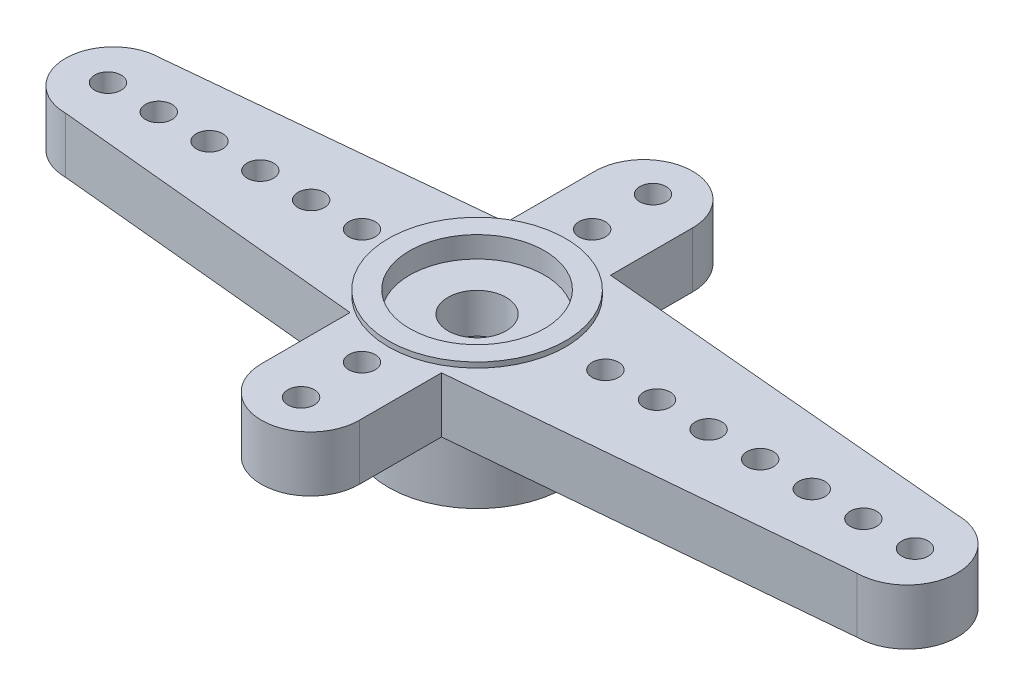
from build123d import *

# Parameters (mm, degrees)
ESQUISSE1_R             = 1.1
BOSS_EXTRU_1_DEPTH      = 2.1
ESQUISSE2_R             = 3.35
ESQUISSE2_R_2           = 2.55
BOSS_EXTRU_2_DEPTH      = 0.2
ENL_V_START             = -0.8
ESQUISSE9_R             = 2.55
ENL_V_MAT_EXTRU_4_DEPTH = 0.8
BOSS_EXTRU_3_START      = 2.5
ESQUISSE5_R             = 3.35
ESQUISSE5_R_2           = 2.55
BOSS_EXTRU_3_DEPTH      = 4.8
ENL_V_MAT_EXTRU_3_REACH = 26.785
ESQUISSE7_R             = 0.5


with BuildPart() as part:
    # Esquisse1 → Boss.-Extru.1 (new body)
    with BuildSketch(Plane(origin=(0, 0, 0), x_dir=(1, 0, 0), z_dir=(0, 1, 0))):
        with BuildLine():
            Line((8.85, 1.9), (-5.55, 3.193286234))
            Line((-5.55, 3.193286234), (-5.55, 6.3))
            ThreePointArc((-5.55, 6.3), (-7.4, 8.15), (-9.25, 6.3))
            Line((-9.25, 6.3), (-9.25, 2.95))
            Line((-9.25, 2.95), (-21.15, 1.8))
            ThreePointArc((-21.15, 1.8), (-22.95, 0), (-21.15, -1.8))
            Line((-21.15, -1.8), (-9.25, -2.95))
            Line((-9.25, -2.95), (-9.25, -6.3))
            ThreePointArc((-9.25, -6.3), (-7.4, -8.15), (-5.55, -6.3))
            Line((-5.55, -6.3), (-5.55, -3.193286234))
            Line((-5.55, -3.193286234), (8.85, -1.9))
            ThreePointArc((8.85, -1.9), (10.75, 0), (8.85, 1.9))
        make_face()
        with Locations(Location((-7.4, 0, 0), (0, 0, 270))):
            Circle(ESQUISSE1_R, mode=Mode.SUBTRACT)
    extrude(amount=BOSS_EXTRU_1_DEPTH)

    # Esquisse2 → Boss.-Extru.2 (add)
    with BuildSketch(Plane(origin=(0, 2.1, 0), x_dir=(1, 0, 0), z_dir=(0, 1, 0))):
        with Locations(Location((-7.4, 0, 0), (0, 0, 270))):
            Circle(ESQUISSE2_R)
        with Locations(Location((-7.4, 0, 0), (0, 0, 270))):
            Circle(ESQUISSE2_R_2, mode=Mode.SUBTRACT)
    extrude(amount=BOSS_EXTRU_2_DEPTH)

    # Esquisse9 → Enlèv. mat.-Extru.4 (cut)
    with BuildSketch(Plane(origin=(0, 2.3, 0), x_dir=(1, 0, 0), z_dir=(0, 1, 0)).offset(ENL_V_START)):
        with Locations(Location((-7.4, 0, 0), (0, 0, 270))):
            Circle(ESQUISSE9_R)
    extrude(amount=ENL_V_MAT_EXTRU_4_DEPTH, mode=Mode.SUBTRACT)

    # Esquisse5 → Boss.-Extru.3 (add)
    with BuildSketch(Plane.XZ.offset(BOSS_EXTRU_3_START)):
        with Locations(Location((-7.4, 0, 0), (0, 0, 90))):
            Circle(ESQUISSE5_R)
        with Locations(Location((-7.4, 0, 0), (0, 0, 90))):
            Circle(ESQUISSE5_R_2, mode=Mode.SUBTRACT)
    extrude(amount=-BOSS_EXTRU_3_DEPTH)

    # Esquisse7 → Enlèv. mat.-Extru.3 (cut, up to next)
    with BuildSketch(Plane(origin=(0, 2.1, 0), x_dir=(1, 0, 0), z_dir=(0, 1, 0)), mode=Mode.PRIVATE) as enl_v_mat_extru_3_sk1:
        with Locations(Location((-7.4, 4.35, 0), (0, 0, 270))):
            Circle(ESQUISSE7_R)
    enl_v_mat_extru_3_tool1 = extrude(enl_v_mat_extru_3_sk1.sketch, amount=-ENL_V_MAT_EXTRU_3_REACH, mode=Mode.PRIVATE) & part.part
    # Esquisse7 → Enlèv. mat.-Extru.3 (cut, up to next)
    with BuildSketch(Plane(origin=(0, 2.1, 0), x_dir=(1, 0, 0), z_dir=(0, 1, 0)), mode=Mode.PRIVATE) as enl_v_mat_extru_3_sk2:
        with Locations(Location((-7.4, 6.65, 0), (0, 0, 270))):
            Circle(ESQUISSE7_R)
    enl_v_mat_extru_3_tool2 = extrude(enl_v_mat_extru_3_sk2.sketch, amount=-ENL_V_MAT_EXTRU_3_REACH, mode=Mode.PRIVATE) & part.part
    # Esquisse7 → Enlèv. mat.-Extru.3 (cut, up to next)
    with BuildSketch(Plane(origin=(0, 2.1, 0), x_dir=(1, 0, 0), z_dir=(0, 1, 0)), mode=Mode.PRIVATE) as enl_v_mat_extru_3_sk3:
        with Locations(Location((-2.55, 0, 0), (0, 0, 270))):
            Circle(ESQUISSE7_R)
    enl_v_mat_extru_3_tool3 = extrude(enl_v_mat_extru_3_sk3.sketch, amount=-ENL_V_MAT_EXTRU_3_REACH, mode=Mode.PRIVATE) & part.part
    # Esquisse7 → Enlèv. mat.-Extru.3 (cut, up to next)
    with BuildSketch(Plane(origin=(0, 2.1, 0), x_dir=(1, 0, 0), z_dir=(0, 1, 0)), mode=Mode.PRIVATE) as enl_v_mat_extru_3_sk4:
        with Locations(Location((-0.6, 0, 0), (0, 0, 270))):
            Circle(ESQUISSE7_R)
    enl_v_mat_extru_3_tool4 = extrude(enl_v_mat_extru_3_sk4.sketch, amount=-ENL_V_MAT_EXTRU_3_REACH, mode=Mode.PRIVATE) & part.part
    # Esquisse7 → Enlèv. mat.-Extru.3 (cut, up to next)
    with BuildSketch(Plane(origin=(0, 2.1, 0), x_dir=(1, 0, 0), z_dir=(0, 1, 0)), mode=Mode.PRIVATE) as enl_v_mat_extru_3_sk5:
        with Locations(Location((1.35, 0, 0), (0, 0, 270))):
            Circle(ESQUISSE7_R)
    enl_v_mat_extru_3_tool5 = extrude(enl_v_mat_extru_3_sk5.sketch, amount=-ENL_V_MAT_EXTRU_3_REACH, mode=Mode.PRIVATE) & part.part
    # Esquisse7 → Enlèv. mat.-Extru.3 (cut, up to next)
    with BuildSketch(Plane(origin=(0, 2.1, 0), x_dir=(1, 0, 0), z_dir=(0, 1, 0)), mode=Mode.PRIVATE) as enl_v_mat_extru_3_sk6:
        with Locations(Location((3.3, 0, 0), (0, 0, 270))):
            Circle(ESQUISSE7_R)
    enl_v_mat_extru_3_tool6 = extrude(enl_v_mat_extru_3_sk6.sketch, amount=-ENL_V_MAT_EXTRU_3_REACH, mode=Mode.PRIVATE) & part.part
    # Esquisse7 → Enlèv. mat.-Extru.3 (cut, up to next)
    with BuildSketch(Plane(origin=(0, 2.1, 0), x_dir=(1, 0, 0), z_dir=(0, 1, 0)), mode=Mode.PRIVATE) as enl_v_mat_extru_3_sk7:
        with Locations(Location((5.25, 0, 0), (0, 0, 270))):
            Circle(ESQUISSE7_R)
    enl_v_mat_extru_3_tool7 = extrude(enl_v_mat_extru_3_sk7.sketch, amount=-ENL_V_MAT_EXTRU_3_REACH, mode=Mode.PRIVATE) & part.part
    # Esquisse7 → Enlèv. mat.-Extru.3 (cut, up to next)
    with BuildSketch(Plane(origin=(0, 2.1, 0), x_dir=(1, 0, 0), z_dir=(0, 1, 0)), mode=Mode.PRIVATE) as enl_v_mat_extru_3_sk8:
        with Locations(Location((7.2, 0, 0), (0, 0, 270))):
            Circle(ESQUISSE7_R)
    enl_v_mat_extru_3_tool8 = extrude(enl_v_mat_extru_3_sk8.sketch, amount=-ENL_V_MAT_EXTRU_3_REACH, mode=Mode.PRIVATE) & part.part
    # Esquisse7 → Enlèv. mat.-Extru.3 (cut, up to next)
    with BuildSketch(Plane(origin=(0, 2.1, 0), x_dir=(1, 0, 0), z_dir=(0, 1, 0)), mode=Mode.PRIVATE) as enl_v_mat_extru_3_sk9:
        with Locations(Location((9.15, 0, 0), (0, 0, 270))):
            Circle(ESQUISSE7_R)
    enl_v_mat_extru_3_tool9 = extrude(enl_v_mat_extru_3_sk9.sketch, amount=-ENL_V_MAT_EXTRU_3_REACH, mode=Mode.PRIVATE) & part.part
    # Esquisse7 → Enlèv. mat.-Extru.3 (cut, up to next)
    with BuildSketch(Plane(origin=(0, 2.1, 0), x_dir=(1, 0, 0), z_dir=(0, 1, 0)), mode=Mode.PRIVATE) as enl_v_mat_extru_3_sk10:
        with Locations(Location((-7.4, -6.65, 0), (0, 0, 270))):
            Circle(ESQUISSE7_R)
    enl_v_mat_extru_3_tool10 = extrude(enl_v_mat_extru_3_sk10.sketch, amount=-ENL_V_MAT_EXTRU_3_REACH, mode=Mode.PRIVATE) & part.part
    # Esquisse7 → Enlèv. mat.-Extru.3 (cut, up to next)
    with BuildSketch(Plane(origin=(0, 2.1, 0), x_dir=(1, 0, 0), z_dir=(0, 1, 0)), mode=Mode.PRIVATE) as enl_v_mat_extru_3_sk11:
        with Locations(Location((-7.4, -4.35, 0), (0, 0, 270))):
            Circle(ESQUISSE7_R)
    enl_v_mat_extru_3_tool11 = extrude(enl_v_mat_extru_3_sk11.sketch, amount=-ENL_V_MAT_EXTRU_3_REACH, mode=Mode.PRIVATE) & part.part
    # Esquisse7 → Enlèv. mat.-Extru.3 (cut, up to next)
    with BuildSketch(Plane(origin=(0, 2.1, 0), x_dir=(1, 0, 0), z_dir=(0, 1, 0)), mode=Mode.PRIVATE) as enl_v_mat_extru_3_sk12:
        with Locations(Location((-11.75, 0, 0), (0, 0, 270))):
            Circle(ESQUISSE7_R)
    enl_v_mat_extru_3_tool12 = extrude(enl_v_mat_extru_3_sk12.sketch, amount=-ENL_V_MAT_EXTRU_3_REACH, mode=Mode.PRIVATE) & part.part
    # Esquisse7 → Enlèv. mat.-Extru.3 (cut, up to next)
    with BuildSketch(Plane(origin=(0, 2.1, 0), x_dir=(1, 0, 0), z_dir=(0, 1, 0)), mode=Mode.PRIVATE) as enl_v_mat_extru_3_sk13:
        with Locations(Location((-13.67, 0, 0), (0, 0, 270))):
            Circle(ESQUISSE7_R)
    enl_v_mat_extru_3_tool13 = extrude(enl_v_mat_extru_3_sk13.sketch, amount=-ENL_V_MAT_EXTRU_3_REACH, mode=Mode.PRIVATE) & part.part
    # Esquisse7 → Enlèv. mat.-Extru.3 (cut, up to next)
    with BuildSketch(Plane(origin=(0, 2.1, 0), x_dir=(1, 0, 0), z_dir=(0, 1, 0)), mode=Mode.PRIVATE) as enl_v_mat_extru_3_sk14:
        with Locations(Location((-15.59, 0, 0), (0, 0, 270))):
            Circle(ESQUISSE7_R)
    enl_v_mat_extru_3_tool14 = extrude(enl_v_mat_extru_3_sk14.sketch, amount=-ENL_V_MAT_EXTRU_3_REACH, mode=Mode.PRIVATE) & part.part
    # Esquisse7 → Enlèv. mat.-Extru.3 (cut, up to next)
    with BuildSketch(Plane(origin=(0, 2.1, 0), x_dir=(1, 0, 0), z_dir=(0, 1, 0)), mode=Mode.PRIVATE) as enl_v_mat_extru_3_sk15:
        with Locations(Location((-17.51, 0, 0), (0, 0, 270))):
            Circle(ESQUISSE7_R)
    enl_v_mat_extru_3_tool15 = extrude(enl_v_mat_extru_3_sk15.sketch, amount=-ENL_V_MAT_EXTRU_3_REACH, mode=Mode.PRIVATE) & part.part
    # Esquisse7 → Enlèv. mat.-Extru.3 (cut, up to next)
    with BuildSketch(Plane(origin=(0, 2.1, 0), x_dir=(1, 0, 0), z_dir=(0, 1, 0)), mode=Mode.PRIVATE) as enl_v_mat_extru_3_sk16:
        with Locations(Location((-19.43, 0, 0), (0, 0, 270))):
            Circle(ESQUISSE7_R)
    enl_v_mat_extru_3_tool16 = extrude(enl_v_mat_extru_3_sk16.sketch, amount=-ENL_V_MAT_EXTRU_3_REACH, mode=Mode.PRIVATE) & part.part
    # Esquisse7 → Enlèv. mat.-Extru.3 (cut, up to next)
    with BuildSketch(Plane(origin=(0, 2.1, 0), x_dir=(1, 0, 0), z_dir=(0, 1, 0)), mode=Mode.PRIVATE) as enl_v_mat_extru_3_sk17:
        with Locations(Location((-21.35, 0, 0), (0, 0, 270))):
            Circle(ESQUISSE7_R)
    enl_v_mat_extru_3_tool17 = extrude(enl_v_mat_extru_3_sk17.sketch, amount=-ENL_V_MAT_EXTRU_3_REACH, mode=Mode.PRIVATE) & part.part
    add(enl_v_mat_extru_3_tool1.solids().sort_by_distance((-7.4, 2.1, -4.35))[0], mode=Mode.SUBTRACT)
    add(enl_v_mat_extru_3_tool2.solids().sort_by_distance((-7.4, 2.1, -6.65))[0], mode=Mode.SUBTRACT)
    add(enl_v_mat_extru_3_tool3.solids().sort_by_distance((-2.55, 2.1, 0))[0], mode=Mode.SUBTRACT)
    add(enl_v_mat_extru_3_tool4.solids().sort_by_distance((-0.6, 2.1, 0))[0], mode=Mode.SUBTRACT)
    add(enl_v_mat_extru_3_tool5.solids().sort_by_distance((1.35, 2.1, 0))[0], mode=Mode.SUBTRACT)
    add(enl_v_mat_extru_3_tool6.solids().sort_by_distance((3.3, 2.1, 0))[0], mode=Mode.SUBTRACT)
    add(enl_v_mat_extru_3_tool7.solids().sort_by_distance((5.25, 2.1, 0))[0], mode=Mode.SUBTRACT)
    add(enl_v_mat_extru_3_tool8.solids().sort_by_distance((7.2, 2.1, 0))[0], mode=Mode.SUBTRACT)
    add(enl_v_mat_extru_3_tool9.solids().sort_by_distance((9.15, 2.1, 0))[0], mode=Mode.SUBTRACT)
    add(enl_v_mat_extru_3_tool10.solids().sort_by_distance((-7.4, 2.1, 6.65))[0], mode=Mode.SUBTRACT)
    add(enl_v_mat_extru_3_tool11.solids().sort_by_distance((-7.4, 2.1, 4.35))[0], mode=Mode.SUBTRACT)
    add(enl_v_mat_extru_3_tool12.solids().sort_by_distance((-11.75, 2.1, 0))[0], mode=Mode.SUBTRACT)
    add(enl_v_mat_extru_3_tool13.solids().sort_by_distance((-13.67, 2.1, 0))[0], mode=Mode.SUBTRACT)
    add(enl_v_mat_extru_3_tool14.solids().sort_by_distance((-15.59, 2.1, 0))[0], mode=Mode.SUBTRACT)
    add(enl_v_mat_extru_3_tool15.solids().sort_by_distance((-17.51, 2.1, 0))[0], mode=Mode.SUBTRACT)
    add(enl_v_mat_extru_3_tool16.solids().sort_by_distance((-19.43, 2.1, 0))[0], mode=Mode.SUBTRACT)
    add(enl_v_mat_extru_3_tool17.solids().sort_by_distance((-21.35, 2.1, 0))[0], mode=Mode.SUBTRACT)


solid = part.part
